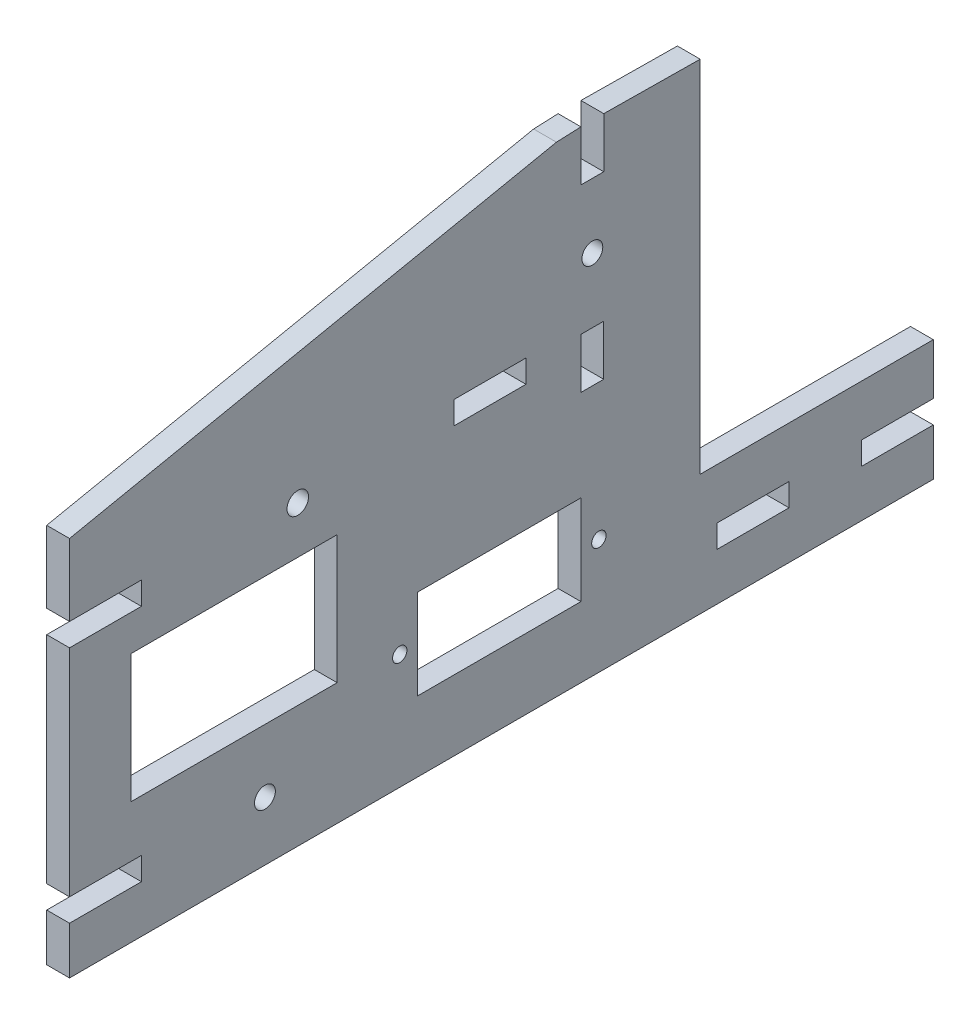
from build123d import *

# Parameters (mm, degrees)
SKETCH1_R      = 1.45
SKETCH1_R_2    = 1
SKETCH1_R_3    = 1.5
SKETCH1_W      = 22.7
SKETCH1_H      = 12.5
SKETCH1_W_2    = 10
SKETCH1_H_2    = 3.175
SKETCH1_W_3    = 3.175
SKETCH1_H_3    = 7
SKETCH1_W_4    = 28.701572838
SKETCH1_H_4    = 17.835977406
EXTRUDE1_DEPTH = 3.175


with BuildPart() as part:
    # Sketch1 → Extrude1 (new body)
    with BuildSketch(Plane(origin=(0, 0, 0), x_dir=(0, 0, -1), z_dir=(1, 0, 0))):
        Polygon((-106.598842421, -37.036692127), (13.557602199, -37.036692127), (13.557602199, -30.485333973), (3.557602199, -30.485333973), (3.557602199, -27.310333973), (13.557602199, -27.310333973), (13.557602199, -20.211692127), (-18.865609087, -20.211692127), (-18.865609087, 29.788307873), (-32.282953974, 29.936573589), (-32.282953974, 22.936573589), (-35.457953974, 22.936573589), (-35.457953974, 29.936573589), (-38.865609087, 29.788307873), (-106.598842421, 15.913307873), (-106.598842421, 5.913307873), (-96.598842421, 5.913307873), (-96.598842421, 2.738307873), (-106.598842421, 2.738307873), (-106.598842421, -27.261692127), (-96.598842421, -27.261692127), (-96.598842421, -30.436692127), (-106.598842421, -30.436692127), align=None)
        with Locations((-79.418842421, -28.849192127)):
            Circle(SKETCH1_R, mode=Mode.SUBTRACT)
        with Locations((-60.661798953, -21.011692127)):
            Circle(SKETCH1_R_2, mode=Mode.SUBTRACT)
        with Locations((-32.961798953, -21.011692127)):
            Circle(SKETCH1_R_2, mode=Mode.SUBTRACT)
        with Locations((-33.870453974, 13.93657382)):
            Circle(SKETCH1_R, mode=Mode.SUBTRACT)
        with Locations((-74.848842421, 4.325807873)):
            Circle(SKETCH1_R_3, mode=Mode.SUBTRACT)
        with Locations((-46.811798953, -21.011692127)):
            Rectangle(SKETCH1_W, SKETCH1_H, mode=Mode.SUBTRACT)
        with Locations((-11.510665381, -28.849192127)):
            Rectangle(SKETCH1_W_2, SKETCH1_H_2, mode=Mode.SUBTRACT)
        with Locations((-48.098842421, 4.325807873)):
            Rectangle(SKETCH1_W_2, SKETCH1_H_2, mode=Mode.SUBTRACT)
        with Locations((-33.874298953, 1.43657382)):
            Rectangle(SKETCH1_W_3, SKETCH1_H_3, mode=Mode.SUBTRACT)
        with Locations((-83.72320649, -11.157017929)):
            Rectangle(SKETCH1_W_4, SKETCH1_H_4, mode=Mode.SUBTRACT)
    extrude(amount=EXTRUDE1_DEPTH)


solid = part.part
